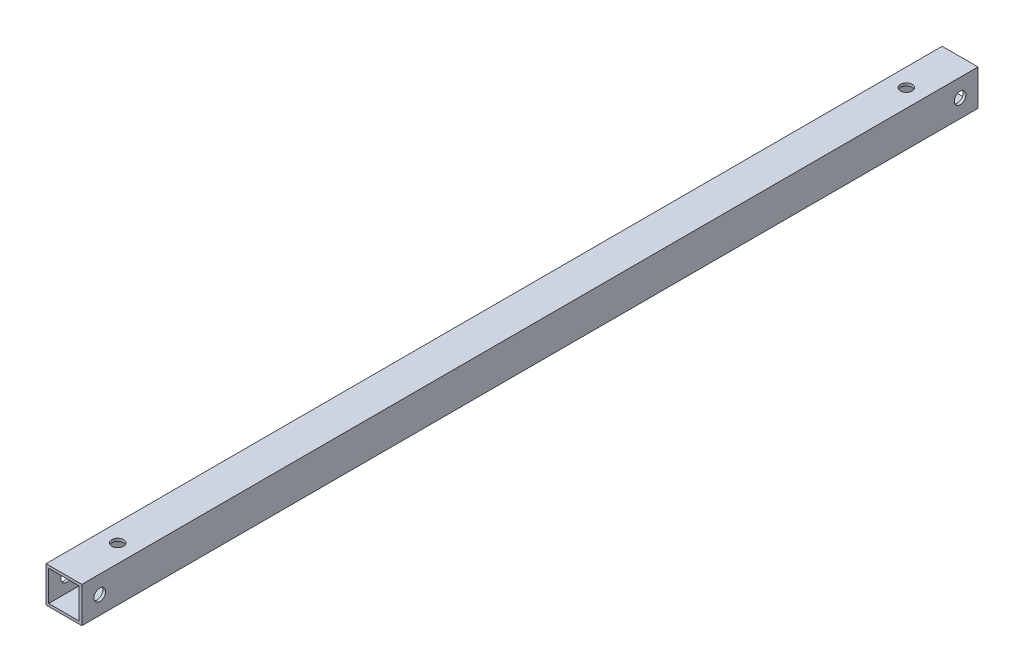
from build123d import *

# Parameters (mm, degrees)
SKIZZE1_W                       = 20
SKIZZE1_H                       = 20
SKIZZE1_W_2                     = 17
SKIZZE1_H_2                     = 17
AUFSATZ_LINEAR_AUSTRAGEN1_DEPTH = 250
SKIZZE2_R                       = 3.25
SCHNITT_LINEAR_AUSTRAGEN1_DEPTH = 15
SKIZZE3_R                       = 3.25
SCHNITT_LINEAR_AUSTRAGEN2_DEPTH = 15


with BuildPart() as part:
    # Skizze1 → Aufsatz-Linear austragen1 (new, symmetric)
    with BuildSketch(Plane.XY):
        Rectangle(SKIZZE1_W, SKIZZE1_H)
        Rectangle(SKIZZE1_W_2, SKIZZE1_H_2, mode=Mode.SUBTRACT)
    extrude(amount=AUFSATZ_LINEAR_AUSTRAGEN1_DEPTH, both=True)

    # Skizze2 → Schnitt-Linear austragen1 (cut, symmetric)
    with BuildSketch(Plane(origin=(0, 0, 0), x_dir=(1, 0, 0), z_dir=(0, 1, 0))):
        with Locations((0, -220)):
            Circle(SKIZZE2_R)
        with Locations((0, 220)):
            Circle(SKIZZE2_R)
    extrude(amount=SCHNITT_LINEAR_AUSTRAGEN1_DEPTH, both=True, mode=Mode.SUBTRACT)

    # Skizze3 → Schnitt-Linear austragen2 (cut, symmetric)
    with BuildSketch(Plane(origin=(0, 0, 0), x_dir=(0, 0, -1), z_dir=(1, 0, 0))):
        with Locations((-240, 0)):
            Circle(SKIZZE3_R)
        with Locations((240, 0)):
            Circle(SKIZZE3_R)
    extrude(amount=SCHNITT_LINEAR_AUSTRAGEN2_DEPTH, both=True, mode=Mode.SUBTRACT)


solid = part.part
